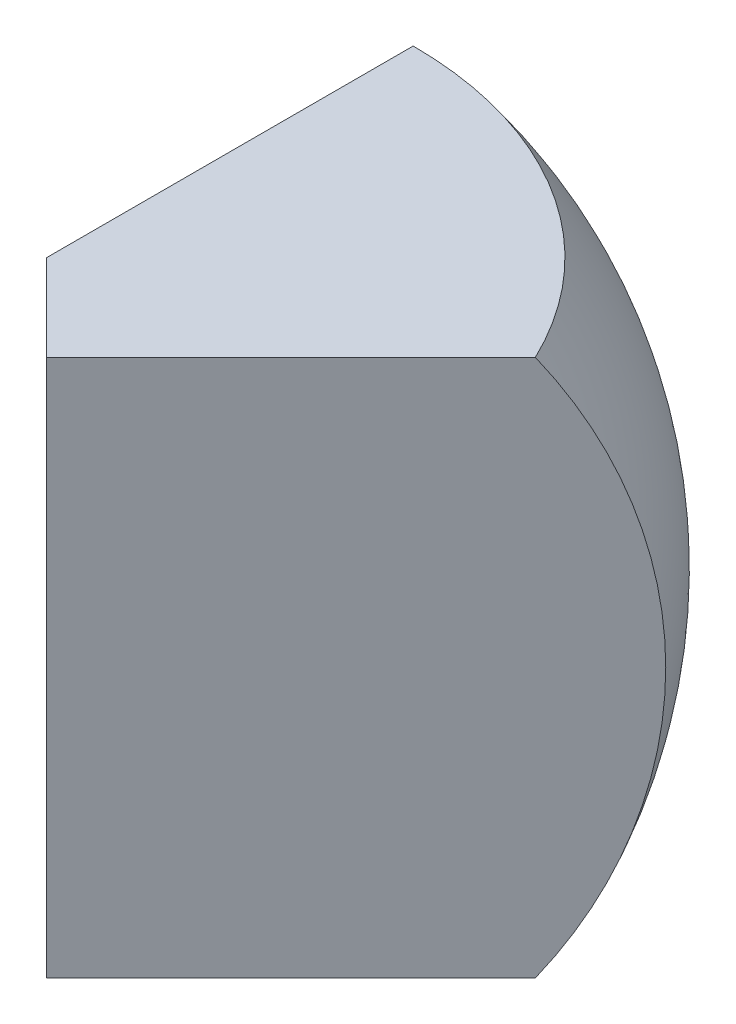
from build123d import *

# Parameters (mm, degrees)
OBR_T1_ANGLE               = 180
WYTNIJ_WYCI_GNI_CIE6_DEPTH = 172.464281995
WYTNIJ_WYCI_GNI_CIE7_DEPTH = 166.271168412


with BuildPart() as part:
    # Szkic1 → Obrót1 (revolve)
    with BuildSketch(Plane(origin=(0, 0, 0), x_dir=(0, 0, -1), z_dir=(1, 0, 0))):
        with BuildLine():
            Line((0, -55), (0, 55))
            Line((0, 55), (-75, 55))
            ThreePointArc((-75, 55), (-93.005376189, 0), (-75, -55))
            Line((-75, -55), (0, -55))
        make_face()
    revolve(axis=Axis((0, -55, 0), (0, 1, 0)), revolution_arc=OBR_T1_ANGLE)

    # Szkic2 → Wytnij-wyciągnięcie6 (cut, through all)
    with BuildSketch(Plane.XZ.offset(55)):
        with BuildLine():
            Line((-50.140376582, 0), (-26.065901524, 0))
            Line((-26.065901524, 0), (-26.065901524, 75))
            Line((-26.065901524, 75), (0, 75))
            ThreePointArc((0, 75), (6.164498497, 74.746230395), (12.287280664, 73.986638888))
            ThreePointArc((12.287280664, 73.986638888), (66.513138224, 34.655482158), (67.67766953, -32.32233047))
            Line((67.67766953, -32.32233047), (87.353699516, -51.998360457))
            Line((87.353699516, -51.998360457), (99.71705874, -51.998360457))
            Line((99.71705874, -51.998360457), (99.71705874, 112.393065192))
            Line((99.71705874, 112.393065192), (-50.140376582, 112.393065192))
            Line((-50.140376582, 112.393065192), (-50.140376582, 0))
        make_face()
    extrude(amount=-WYTNIJ_WYCI_GNI_CIE6_DEPTH, mode=Mode.SUBTRACT)

    # Szkic6 → Wytnij-wyciągnięcie7 (cut, through all)
    with BuildSketch(Plane.XZ.offset(55)):
        with BuildLine():
            ThreePointArc((67.67766953, -32.32233047), (63.439635817, 40.00515726), (0, 75))
            Line((0, 75), (0, 0))
            Line((0, 0), (17.67766953, 17.67766953))
            Line((17.67766953, 17.67766953), (67.67766953, -32.32233047))
        make_face()
    extrude(amount=-WYTNIJ_WYCI_GNI_CIE7_DEPTH, mode=Mode.SUBTRACT)


solid = part.part
